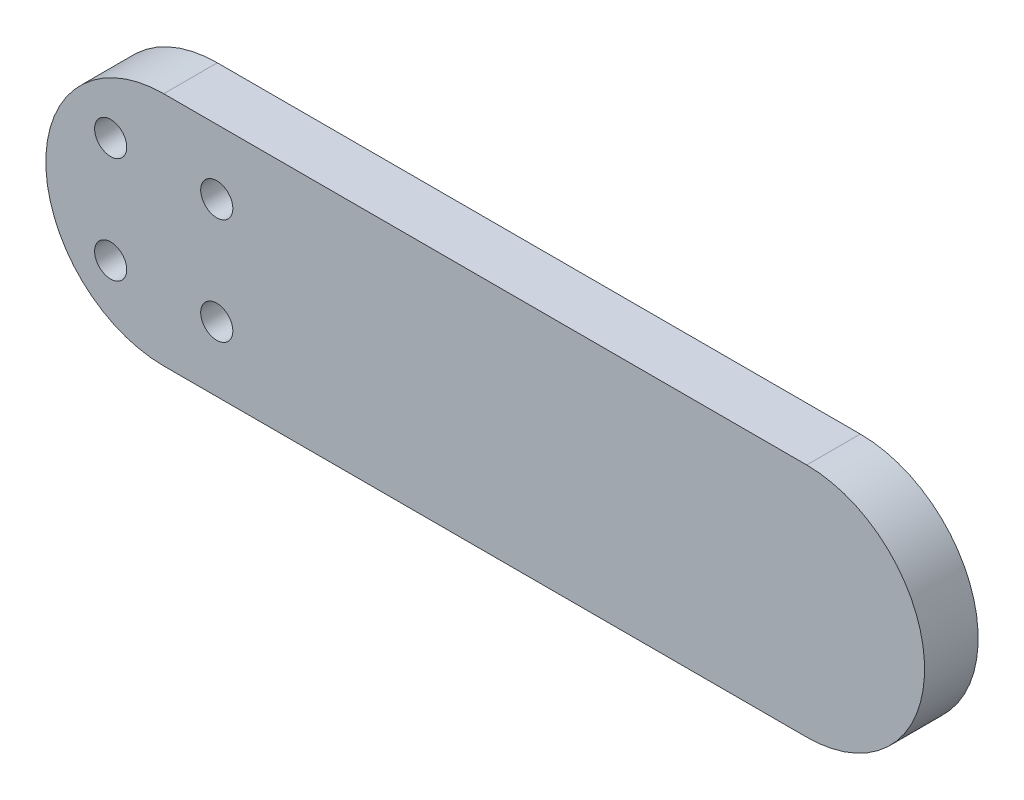
from build123d import *

# Parameters (mm, degrees)
SKETCH1_R           = 1.5
BOSS_EXTRUDE2_DEPTH = 5


with BuildPart() as part:
    # Sketch1 → Boss-Extrude2 (new body)
    with BuildSketch(Plane.XY):
        with BuildLine():
            Line((0, 11), (60, 11))
            ThreePointArc((60, 11), (71, 0), (60, -11))
            Line((60, -11), (0, -11))
            ThreePointArc((0, -11), (-11, 0), (0, 11))
        make_face()
        with Locations((-4.949747468, 4.949747468)):
            Circle(SKETCH1_R, mode=Mode.SUBTRACT)
        with Locations((4.949747468, 4.949747468)):
            Circle(SKETCH1_R, mode=Mode.SUBTRACT)
        with Locations((4.949747468, -4.949747468)):
            Circle(SKETCH1_R, mode=Mode.SUBTRACT)
        with Locations((-4.949747468, -4.949747468)):
            Circle(SKETCH1_R, mode=Mode.SUBTRACT)
    extrude(amount=BOSS_EXTRUDE2_DEPTH)


solid = part.part
